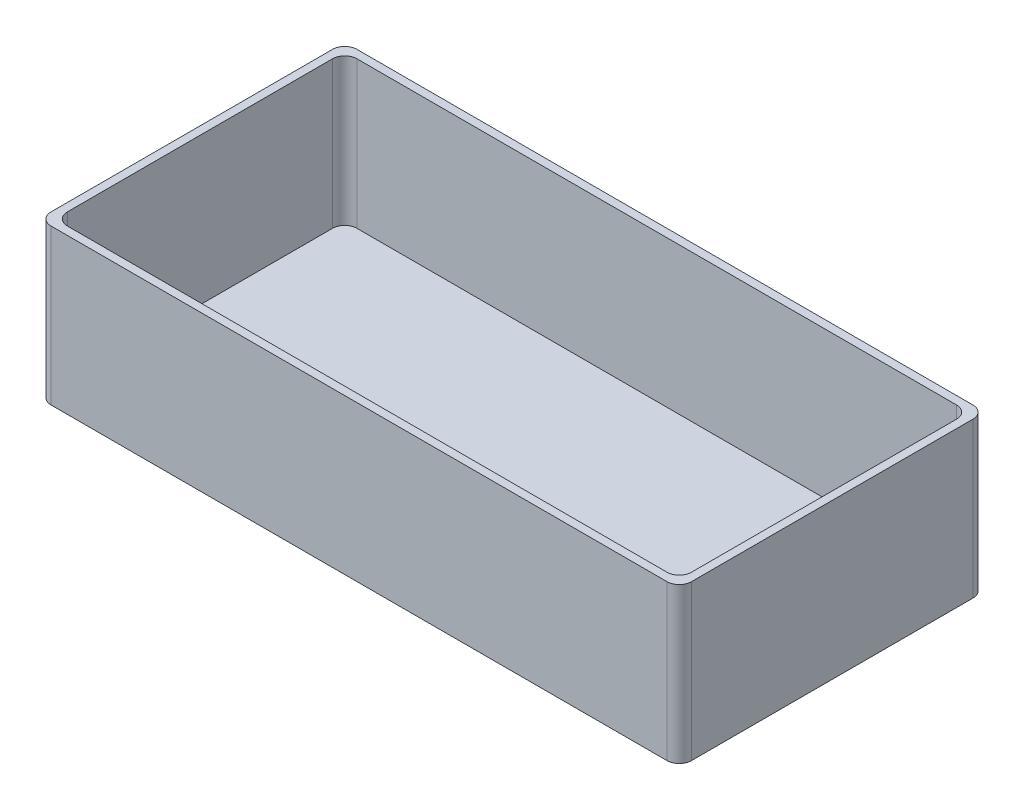
from build123d import *

# Parameters (mm, degrees)
SKETCH1_W           = 157
SKETCH1_H           = 75
BOSS_EXTRUDE1_DEPTH = 38
SHELL1_T            = -2
FILLET1_R           = 3


with BuildPart() as part:
    # Sketch1 → Boss-Extrude1 (new body)
    with BuildSketch(Plane(origin=(0, 0, 0), x_dir=(1, 0, 0), z_dir=(0, 1, 0))):
        with Locations((-78.5, 37.5)):
            Rectangle(SKETCH1_W, SKETCH1_H)
    extrude(amount=BOSS_EXTRUDE1_DEPTH)

    # Shell1
    shell1_openings = [part.faces().sort_by_distance(p)[0] for p in [
        (-78.5, 38, -37.5),
    ]]
    offset(amount=SHELL1_T, openings=shell1_openings, kind=Kind.INTERSECTION)

    # Fillet1
    fillet1_edges = [part.edges().sort_by_distance(p)[0] for p in [
        (-2, 20, -2),
        (-2, 20, -73),
        (-155, 20, -73),
        (-155, 20, -2),
        (0, 19, 0),
        (-157, 19, 0),
        (-157, 19, -75),
        (0, 19, -75),
    ]]
    fillet(fillet1_edges, radius=FILLET1_R)


solid = part.part
